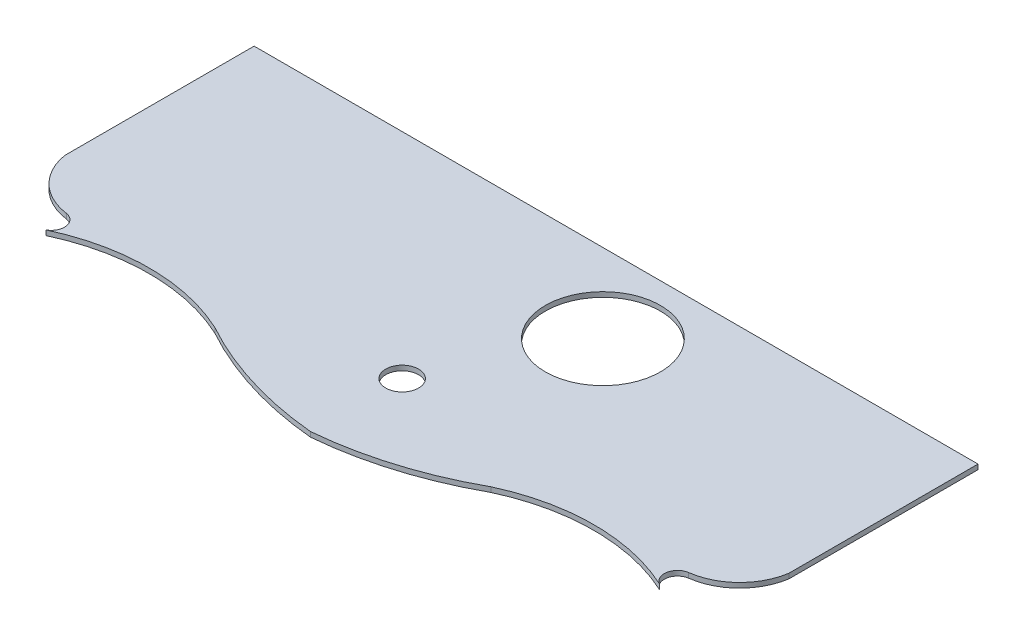
from build123d import *

# Parameters (mm, degrees)
SKETCH2_R           = 17.5
SKETCH2_R_2         = 5
BOSS_EXTRUDE2_DEPTH = 1.5


with BuildPart() as part:
    # Sketch2 → Boss-Extrude2 (new body)
    with BuildSketch(Plane(origin=(0, 22.5, 0), x_dir=(1, 0, 0), z_dir=(0, 1, 0))):
        with BuildLine():
            Line((-110, 50), (110, 50))
            Line((110, 50), (110, -7.5))
            ThreePointArc((110, -7.5), (104.755451902, -17.601037804), (94.5, -22.536820999))
            ThreePointArc((94.5, -22.536820999), (91.210601206, -25.822153148), (93.25, -30))
            ThreePointArc((93.25, -30), (67.606257623, -24.318329423), (41.962515246, -30))
            ThreePointArc((41.962515246, -30), (21.653208784, -38.627914511), (0, -42.876136156))
            ThreePointArc((0, -42.876136156), (-21.653208784, -38.627914511), (-41.962515246, -30))
            ThreePointArc((-41.962515246, -30), (-67.606257623, -24.318329423), (-93.25, -30))
            ThreePointArc((-93.25, -30), (-91.210601206, -25.822153148), (-94.5, -22.536820999))
            ThreePointArc((-94.5, -22.536820999), (-104.755451902, -17.601037804), (-110, -7.5))
            Line((-110, -7.5), (-110, 50))
        make_face()
        with Locations(Location((20, 26, 0), (0, 0, 270))):
            Circle(SKETCH2_R, mode=Mode.SUBTRACT)
        with Locations(Location((0, -15, 0), (0, 0, 270))):
            Circle(SKETCH2_R_2, mode=Mode.SUBTRACT)
    extrude(amount=BOSS_EXTRUDE2_DEPTH)


solid = part.part
